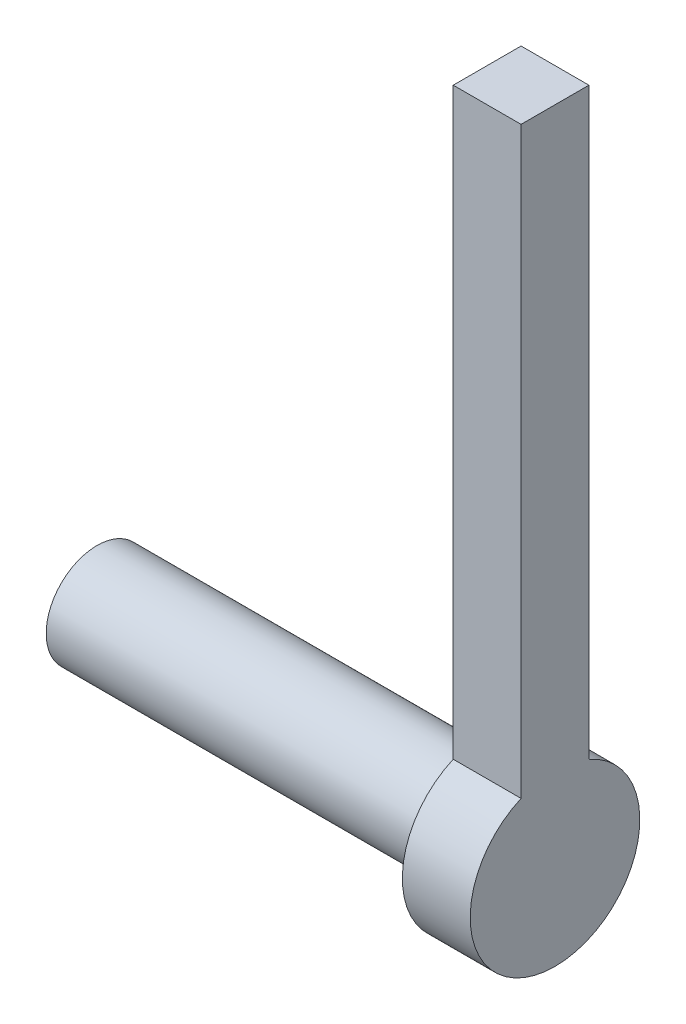
from build123d import *

# Parameters (mm, degrees)
SERVICE_PIN_SHANK_SKETCH_R = 1.5
SERVICE_PIN_SHANK_DEPTH    = 11.5
SERVICE_PIN_HEAD_SKETCH_R  = 2.5
SERVICE_PIN_HEAD_DEPTH     = 2
LOCK_SWITCH_FLAG_SKETCH_W  = 2
LOCK_SWITCH_FLAG_SKETCH_H  = 19.5
LOCK_SWITCH_FLAG_DEPTH     = 2


with BuildPart() as part:
    # Service pin shank sketch → Service pin shank (new body)
    with BuildSketch(Plane(origin=(-12, 0, 0), x_dir=(0, 0, -1), z_dir=(1, 0, 0))):
        with Locations((10.5, -29)):
            Circle(SERVICE_PIN_SHANK_SKETCH_R)
    extrude(amount=SERVICE_PIN_SHANK_DEPTH)

    # Service pin head sketch → Service pin head (add)
    with BuildSketch(Plane(origin=(-0.5, 0, 0), x_dir=(0, 0, -1), z_dir=(1, 0, 0))):
        with Locations((10.5, -29)):
            Circle(SERVICE_PIN_HEAD_SKETCH_R)
    extrude(amount=SERVICE_PIN_HEAD_DEPTH)

    # Lock switch flag sketch → Lock switch flag (add)
    with BuildSketch(Plane.XY.offset(-11.5)):
        with Locations((0.5, -38.75)):
            Rectangle(LOCK_SWITCH_FLAG_SKETCH_W, LOCK_SWITCH_FLAG_SKETCH_H)
    extrude(amount=LOCK_SWITCH_FLAG_DEPTH)


with BuildPart() as body_2:
    # Mirror1: mirrored copy
    add(part.part.mirror(Plane(origin=(0, 0, 0), x_dir=(0, 0, 1), z_dir=(0, -1, 0))))


solid = body_2.part
